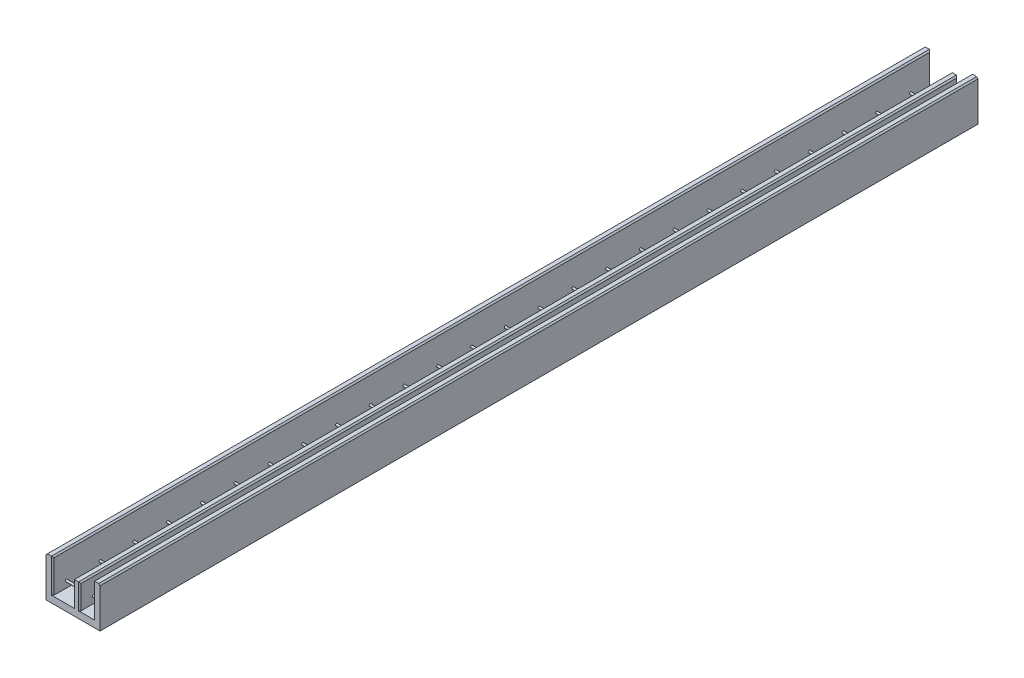
from build123d import *

# Parameters (mm, degrees)
SALIENTE_EXTRUIR1_DEPTH = 13000
CHAFL_N2_SIZE           = 20
SALIENTE_EXTRUIR2_REACH = 13040.405
CROQUIS2_R              = 15
MATRIZL1_COUNT          = 26
MATRIZL1_PITCH          = 500


with BuildPart() as part:
    # Croquis1 → Saliente-Extruir1 (new body)
    with BuildSketch(Plane.XY):
        Polygon((0, 0), (-800, 0), (-800, 600), (-700, 600), (-700, 100), (-400, 100), (-400, 470), (-300, 470), (-300, 100), (-100, 100), (-100, 600), (0, 600), align=None)
    extrude(amount=SALIENTE_EXTRUIR1_DEPTH)

    # Chaflán2
    chafl_n2_edges = [part.edges().sort_by_distance(p)[0] for p in [
        (-100, 350, 13000),
        (-700, 350, 0),
        (-400, 285, 0),
        (-300, 285, 0),
        (-100, 350, 0),
        (-300, 285, 13000),
        (-800, 600, 6500),
        (-700, 600, 6500),
        (-400, 470, 6500),
        (-300, 470, 6500),
        (-100, 600, 6500),
        (0, 600, 6500),
        (-400, 285, 13000),
        (-700, 350, 13000),
    ]]
    chamfer(chafl_n2_edges, length=CHAFL_N2_SIZE)

    # Saliente-Extruir2: up to this face of the body (flat: up to its plane)
    saliente_extruir2_end = Plane(part.part.faces().sort_by_distance((-100, 340, 6500))[0])
    # Croquis2 → Saliente-Extruir2 (add, up to the picked face)
    with BuildSketch(Plane.ZY.offset(800), mode=Mode.PRIVATE) as saliente_extruir2_sk1:
        with Locations(Location((300, 200, 0), (0, 0, 270))):
            Circle(CROQUIS2_R)
    saliente_extruir2_tool1 = split(extrude(saliente_extruir2_sk1.sketch, amount=-SALIENTE_EXTRUIR2_REACH, mode=Mode.PRIVATE), bisect_by=saliente_extruir2_end, keep=Keep.BOTH, mode=Mode.PRIVATE)
    saliente_extruir2 = saliente_extruir2_tool1.solids().sort_by(Axis((-800, 200, 300), (1, 0, 0)))[0]
    add(saliente_extruir2)

    # MatrizL1: Saliente-Extruir2 ×26
    with Locations(*[(0, 0, i * MATRIZL1_PITCH) for i in range(1, MATRIZL1_COUNT)]):
        add(saliente_extruir2)


solid = part.part
